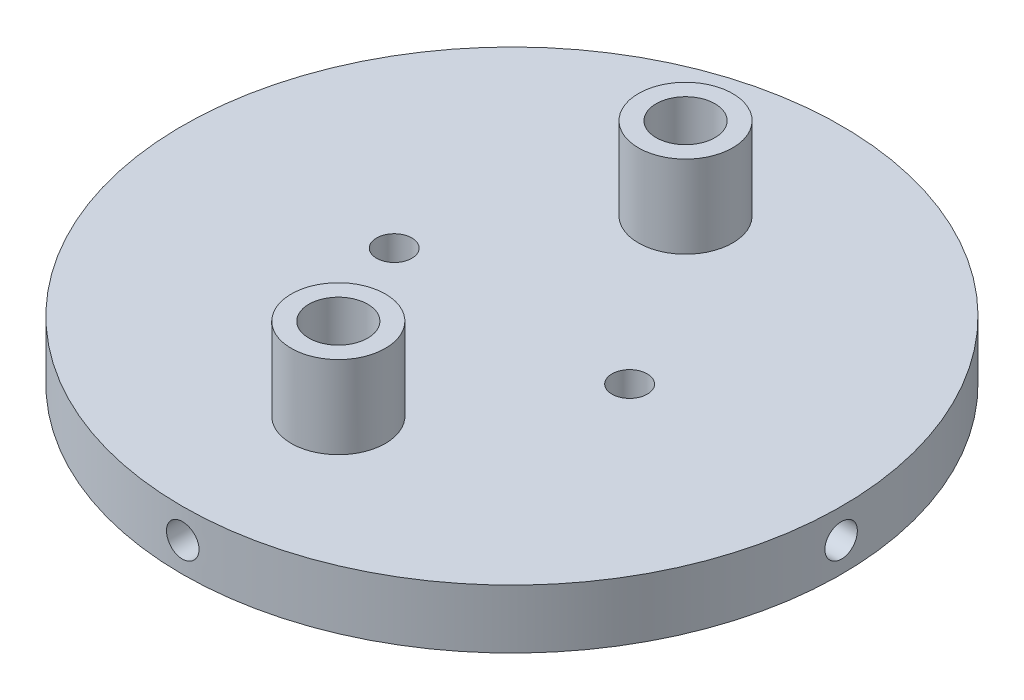
from build123d import *

# Parameters (mm, degrees)
SKETCH1_R           = 35.56
BOSS_EXTRUDE1_DEPTH = 6.35
SKETCH3_R           = 1.905
CUT_EXTRUDE1_DEPTH  = 6.35
SKETCH4_R           = 5.08
SKETCH4_R_2         = 2.54
BOSS_EXTRUDE2_DEPTH = 8.89
SKETCH5_R           = 1.5
CUT_EXTRUDE2_DEPTH  = 10
SKETCH6_R           = 3.175
CUT_EXTRUDE3_DEPTH  = 8.89
CUT_EXTRUDE4_START  = 40.64
SKETCH8_R           = 1.7526
CUT_EXTRUDE4_DEPTH  = 17.78
CIRPATTERN1_COUNT   = 4


with BuildPart() as part:
    # Sketch1 → Boss-Extrude1 (new body)
    with BuildSketch(Plane(origin=(0, 0, 0), x_dir=(1, 0, 0), z_dir=(0, 1, 0))):
        with Locations(Location((0, 0, 0), (0, 0, 270))):
            Circle(SKETCH1_R)
    extrude(amount=BOSS_EXTRUDE1_DEPTH)

    # Sketch3 → Cut-Extrude1 (cut)
    with BuildSketch(Plane(origin=(0, 6.35, 0), x_dir=(1, 0, 0), z_dir=(0, 1, 0))):
        with Locations(Location((-12.7, 0, 0), (0, 0, 270))):
            Circle(SKETCH3_R)
        with Locations(Location((12.7, 0, 0), (0, 0, 270))):
            Circle(SKETCH3_R)
    extrude(amount=-CUT_EXTRUDE1_DEPTH, mode=Mode.SUBTRACT)

    # Sketch4 → Boss-Extrude2 (add)
    with BuildSketch(Plane(origin=(0, 6.35, 0), x_dir=(1, 0, 0), z_dir=(0, 1, 0))):
        with Locations(Location((0, 18.7325, 0), (0, 0, 270))):
            Circle(SKETCH4_R)
        with Locations(Location((0, 18.7325, 0), (0, 0, 270))):
            Circle(SKETCH4_R_2, mode=Mode.SUBTRACT)
    boss_extrude2 = extrude(amount=BOSS_EXTRUDE2_DEPTH)

    # Mirror1: Boss-Extrude2 across plane
    add(boss_extrude2.mirror(Plane.XY))

    # Sketch5 → Cut-Extrude2 (cut)
    with BuildSketch(Plane(origin=(0, 6.35, 0), x_dir=(1, 0, 0), z_dir=(0, 1, 0))):
        with Locations(Location((0, 18.7325, 0), (0, 0, 270))):
            Circle(SKETCH5_R)
        with Locations(Location((0, -18.7325, 0), (0, 0, 270))):
            Circle(SKETCH5_R)
    extrude(amount=-CUT_EXTRUDE2_DEPTH, mode=Mode.SUBTRACT)

    # Sketch6 → Cut-Extrude3 (cut)
    with BuildSketch(Plane(origin=(0, 15.24, 0), x_dir=(1, 0, 0), z_dir=(0, 1, 0))):
        with Locations(Location((0, 18.7325, 0), (0, 0, 270))):
            Circle(SKETCH6_R)
        with Locations(Location((0, -18.7325, 0), (0, 0, 270))):
            Circle(SKETCH6_R)
    extrude(amount=-CUT_EXTRUDE3_DEPTH, mode=Mode.SUBTRACT)

    # Sketch8 → Cut-Extrude4 (cut)
    with BuildSketch(Plane(origin=(0, 0, 0), x_dir=(0, 0, -1), z_dir=(1, 0, 0)).offset(CUT_EXTRUDE4_START)):
        with Locations((0, 3.175)):
            Circle(SKETCH8_R)
    cut_extrude4 = extrude(amount=-CUT_EXTRUDE4_DEPTH, mode=Mode.SUBTRACT)

    # CirPattern1: Cut-Extrude4 ×4 about axis
    cirpattern1_axis = Axis((0, 0, 0), (0, 1, 0))
    for i in range(1, CIRPATTERN1_COUNT):
        add(cut_extrude4.rotate(cirpattern1_axis, i * 360 / CIRPATTERN1_COUNT), mode=Mode.SUBTRACT)


solid = part.part
